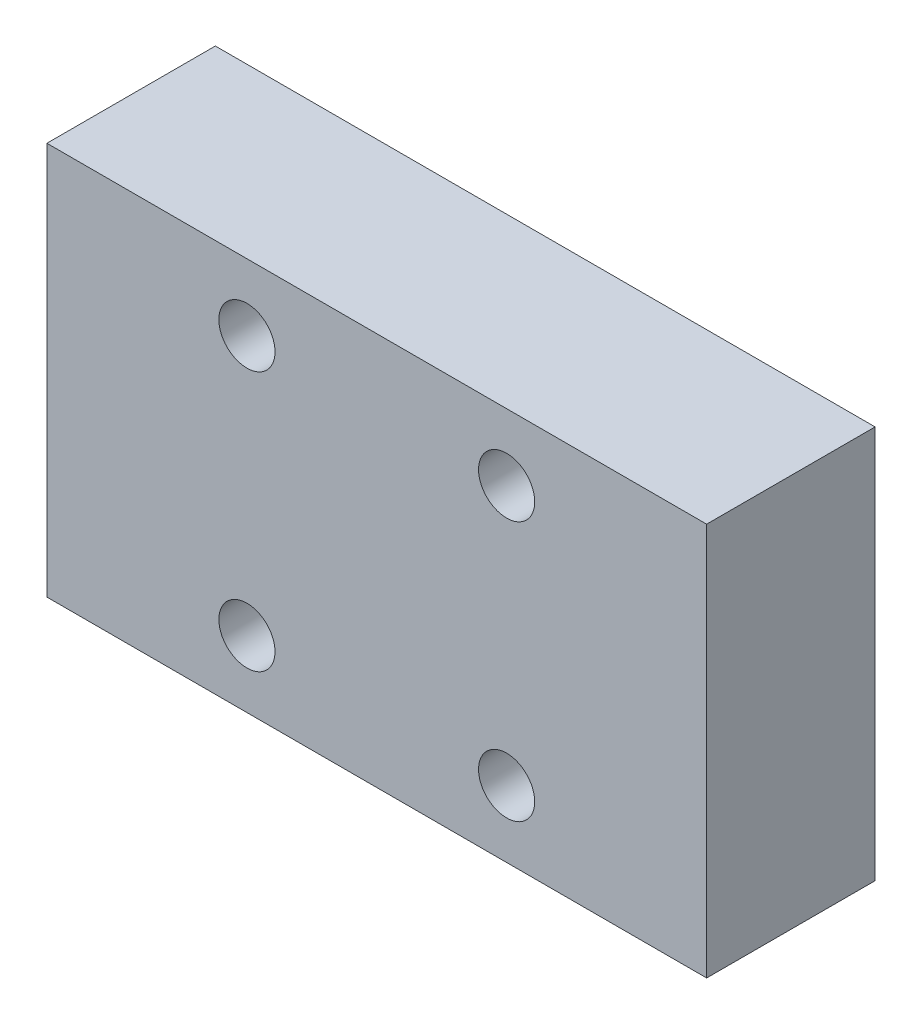
from build123d import *

# Parameters (mm, degrees)
SKETCH_1_W          = 47
SKETCH_1_H          = 28
EXTRUDE_1_DEPTH     = 12
SKETCH_2_R          = 2
CUT_EXTRUDE_1_DEPTH = 12


with BuildPart() as part:
    # 草图1 → 凸台-拉伸1 (new body)
    with BuildSketch(Plane.XY):
        with Locations((-10.441605839, 22.569343066)):
            Rectangle(SKETCH_1_W, SKETCH_1_H)
    extrude(amount=EXTRUDE_1_DEPTH)

    # 草图2 → 切除-拉伸1 (cut)
    with BuildSketch(Plane.XY.offset(12)):
        with Locations((-19.691605839, 31.819343066)):
            Circle(SKETCH_2_R)
        with Locations(Location((-1.191605839, 31.819343066, 0), (0, 0, 180))):
            Circle(SKETCH_2_R)
        with Locations((-1.191605839, 13.319343066)):
            Circle(SKETCH_2_R)
        with Locations(Location((-19.691605839, 13.319343066, 0), (0, 0, 180))):
            Circle(SKETCH_2_R)
    extrude(amount=-CUT_EXTRUDE_1_DEPTH, mode=Mode.SUBTRACT)


solid = part.part
